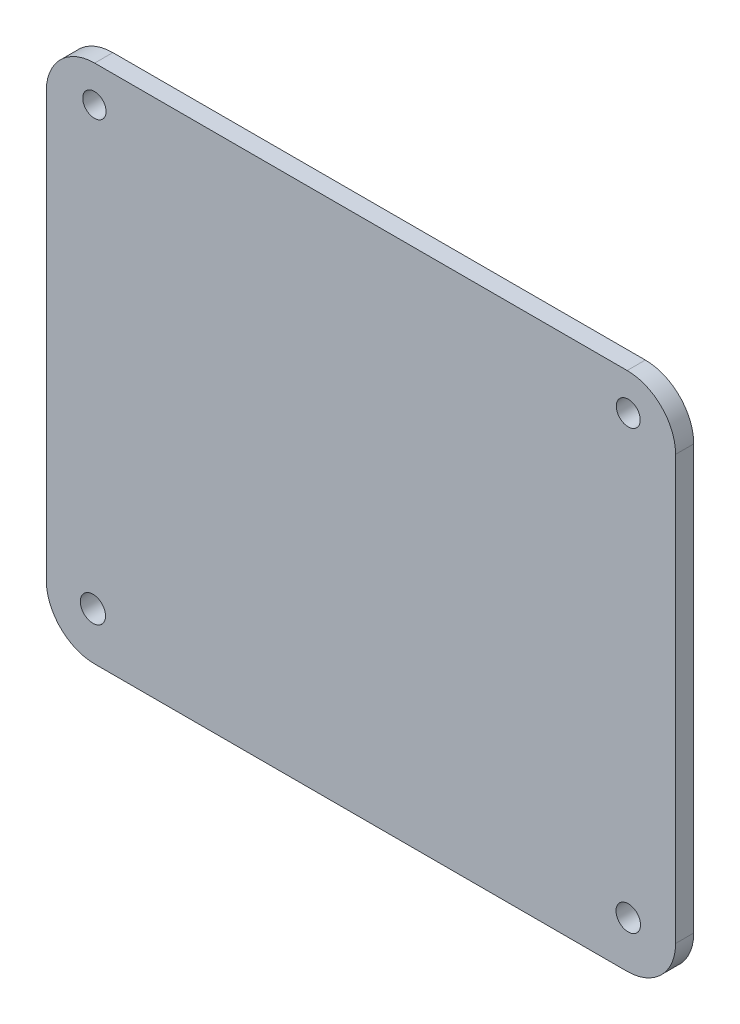
from build123d import *

# Parameters (mm, degrees)
BOSS_EXTRUDE1_DEPTH = 3.81
CUT_EXTRUDE1_REACH  = 87.779
SKETCH2_R           = 2.447521694
SKETCH2_R_2         = 2.514751493
SKETCH2_R_3         = 2.570723965
SKETCH2_R_4         = 2.649131916


with BuildPart() as part:
    # Sketch1 → Boss-Extrude1 (new body)
    with BuildSketch(Plane.XY):
        with BuildLine():
            Line((55.88, -54.61), (-55.88, -54.61))
            ThreePointArc((-55.88, -54.61), (-63.064204897, -51.634204897), (-66.04, -44.45))
            Line((-66.04, -44.45), (-66.04, 44.45))
            ThreePointArc((-66.04, 44.45), (-63.064204897, 51.634204897), (-55.88, 54.61))
            Line((-55.88, 54.61), (55.88, 54.61))
            ThreePointArc((55.88, 54.61), (63.064204897, 51.634204897), (66.04, 44.45))
            Line((66.04, 44.45), (66.04, -44.45))
            ThreePointArc((66.04, -44.45), (63.064204897, -51.634204897), (55.88, -54.61))
        make_face()
    extrude(amount=BOSS_EXTRUDE1_DEPTH)

    # Sketch2 → Cut-Extrude1 (cut, up to next)
    with BuildSketch(Plane.XY.offset(3.81), mode=Mode.PRIVATE) as cut_extrude1_sk1:
        with Locations((-55.936087501, 46.99)):
            Circle(SKETCH2_R)
    cut_extrude1_tool1 = extrude(cut_extrude1_sk1.sketch, amount=-CUT_EXTRUDE1_REACH, mode=Mode.PRIVATE) & part.part
    # Sketch2 → Cut-Extrude1 (cut, up to next)
    with BuildSketch(Plane.XY.offset(3.81), mode=Mode.PRIVATE) as cut_extrude1_sk2:
        with Locations((56.105983157, 46.99)):
            Circle(SKETCH2_R_2)
    cut_extrude1_tool2 = extrude(cut_extrude1_sk2.sketch, amount=-CUT_EXTRUDE1_REACH, mode=Mode.PRIVATE) & part.part
    # Sketch2 → Cut-Extrude1 (cut, up to next)
    with BuildSketch(Plane.XY.offset(3.81), mode=Mode.PRIVATE) as cut_extrude1_sk3:
        with Locations((56.105983157, -44.758153673)):
            Circle(SKETCH2_R_3)
    cut_extrude1_tool3 = extrude(cut_extrude1_sk3.sketch, amount=-CUT_EXTRUDE1_REACH, mode=Mode.PRIVATE) & part.part
    # Sketch2 → Cut-Extrude1 (cut, up to next)
    with BuildSketch(Plane.XY.offset(3.81), mode=Mode.PRIVATE) as cut_extrude1_sk4:
        with Locations((-56.244241173, -44.758153673)):
            Circle(SKETCH2_R_4)
    cut_extrude1_tool4 = extrude(cut_extrude1_sk4.sketch, amount=-CUT_EXTRUDE1_REACH, mode=Mode.PRIVATE) & part.part
    add(cut_extrude1_tool1.solids().sort_by_distance((-55.936088, 46.99, 3.81))[0], mode=Mode.SUBTRACT)
    add(cut_extrude1_tool2.solids().sort_by_distance((56.105983, 46.99, 3.81))[0], mode=Mode.SUBTRACT)
    add(cut_extrude1_tool3.solids().sort_by_distance((56.105983, -44.758154, 3.81))[0], mode=Mode.SUBTRACT)
    add(cut_extrude1_tool4.solids().sort_by_distance((-56.244241, -44.758154, 3.81))[0], mode=Mode.SUBTRACT)


solid = part.part
